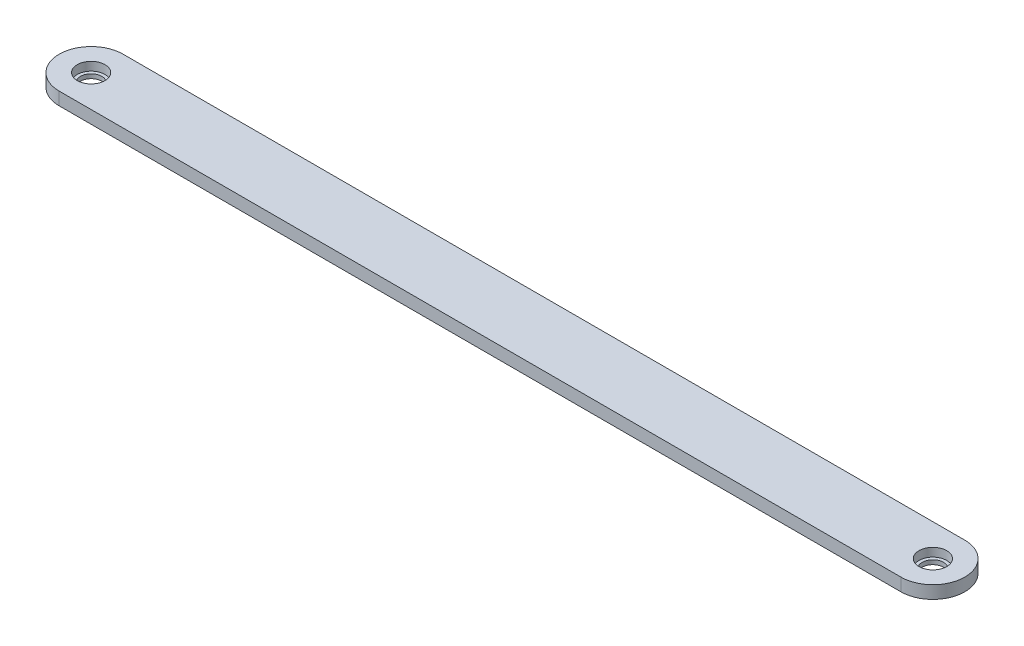
from build123d import *

# Parameters (mm, degrees)
SKETCH2_R           = 5
BOSS_EXTRUDE1_DEPTH = 6
SKETCH4_R           = 6.5
CUT_EXTRUDE2_DEPTH  = 4


with BuildPart() as part:
    # Sketch2 → Boss-Extrude1 (new body)
    with BuildSketch(Plane(origin=(0, 0, 0), x_dir=(1, 0, 0), z_dir=(0, 1, 0))):
        with BuildLine():
            Line((-45, 15), (350, 15))
            ThreePointArc((350, 15), (365, 0), (350, -15))
            Line((350, -15), (-45, -15))
            ThreePointArc((-45, -15), (-60, 0), (-45, 15))
        make_face()
        with Locations(Location((-45, 0, 0), (0, 0, 270))):
            Circle(SKETCH2_R, mode=Mode.SUBTRACT)
        with Locations(Location((350, 0, 0), (0, 0, 270))):
            Circle(SKETCH2_R, mode=Mode.SUBTRACT)
    extrude(amount=BOSS_EXTRUDE1_DEPTH)

    # Sketch4 → Cut-Extrude2 (cut)
    with BuildSketch(Plane(origin=(0, 6, 0), x_dir=(1, 0, 0), z_dir=(0, 1, 0))):
        with Locations(Location((-45, 0, 0), (0, 0, 270))):
            Circle(SKETCH4_R)
        with Locations(Location((350, 0, 0), (0, 0, 270))):
            Circle(SKETCH4_R)
    extrude(amount=-CUT_EXTRUDE2_DEPTH, mode=Mode.SUBTRACT)


solid = part.part
